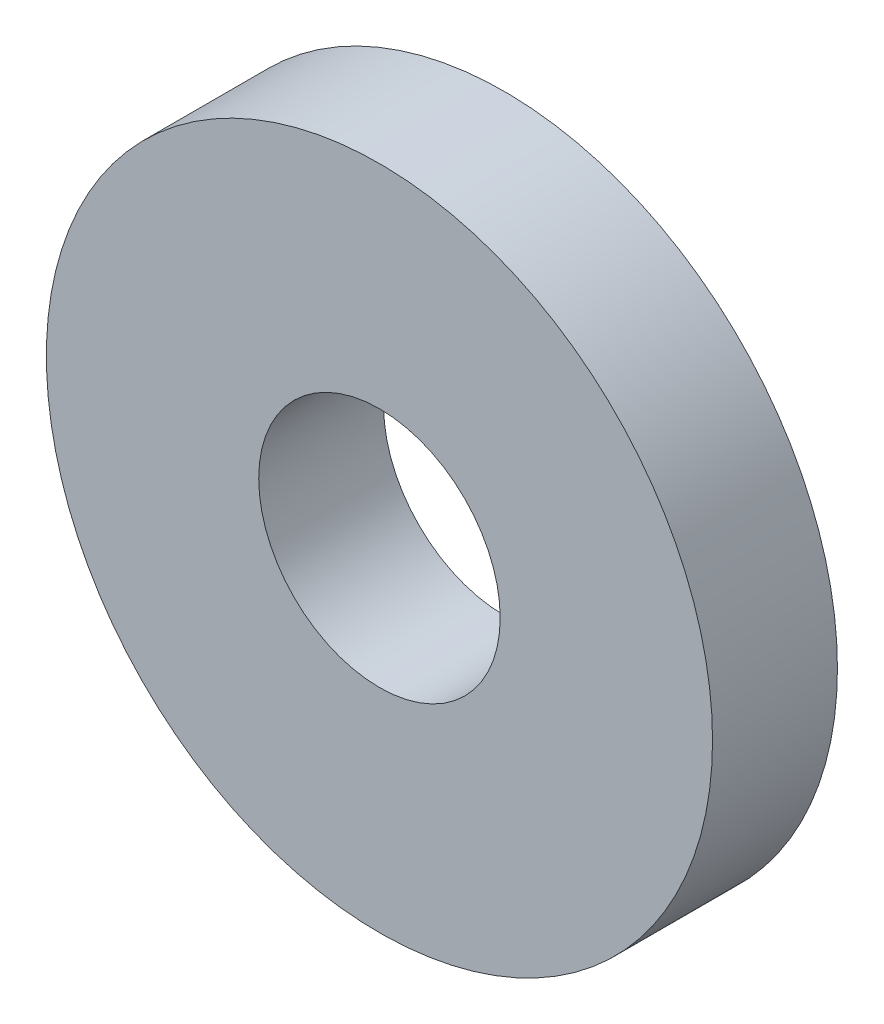
from build123d import *

# Parameters (mm, degrees)
SKETCH1_R           = 4
SKETCH1_R_2         = 1.45
BOSS_EXTRUDE1_DEPTH = 1.5


with BuildPart() as part:
    # Sketch1 → Boss-Extrude1 (new body)
    with BuildSketch(Plane.XY):
        Circle(SKETCH1_R)
        Circle(SKETCH1_R_2, mode=Mode.SUBTRACT)
    extrude(amount=BOSS_EXTRUDE1_DEPTH)


solid = part.part
